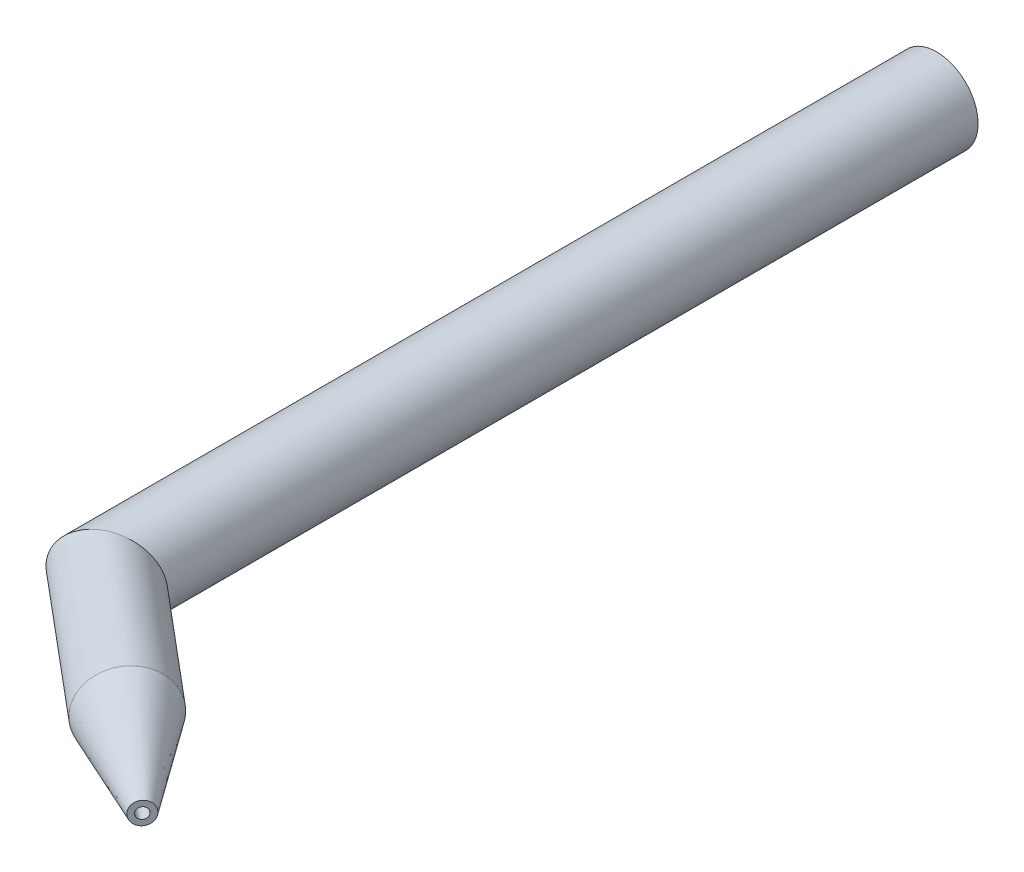
from build123d import *

# Parameters (mm, degrees)
SKETCH_1_R      = 7.5
SKETCH_1_R_2    = 4.5
EXTRUDE_1_DEPTH = 100
SKETCH_3_R      = 7.5
SKETCH_3_R_2    = 4.5
EXTRUDE_START   = 20
SKETCH_6_R      = 7.5
SKETCH_6_R_2    = 4.5
EXTRUDE_2_DEPTH = 20


with BuildPart() as part:
    # 草图1 → 凸台-拉伸1 (new body)
    with BuildSketch(Plane.XY):
        Circle(SKETCH_1_R)
        Circle(SKETCH_1_R_2, mode=Mode.SUBTRACT)
    extrude(amount=EXTRUDE_1_DEPTH)

    # 扫描1: sweep along a path in 草图2
    with BuildLine(Plane(origin=(0, 0, 0), x_dir=(1, 0, 0), z_dir=(0, 1, 0))) as sweep_1_path:
        Line((0, -100), (0, -130))
        Line((0, -130), (22.981333294, -149.283628291))
    # 草图3 → 扫描1 (sweep)
    with BuildSketch(Plane.XY.offset(100)):
        Circle(SKETCH_3_R)
        Circle(SKETCH_3_R_2, mode=Mode.SUBTRACT)
    sweep(path=sweep_1_path.line, transition=Transition.RIGHT)

    # 草图5 → 旋转1 (revolve)
    with BuildSketch(Plane(origin=(0, 0, 0), x_dir=(1, 0, 0), z_dir=(0, 1, 0)), mode=Mode.PRIVATE) as revolve_1_sk:
        Polygon((27.802240366, -143.538294967), (25.873877537, -145.836428297), (33.630329642, -156.91378991), (40.52252136, -162.697025438), (41.16530897, -161.930980995), (35.728697758, -154.448127615), align=None)
    revolve(revolve_1_sk.sketch.rotate(Axis((0, 0, 130), (0.7660444431189799, 0, 0.6427876096865373)), 180), axis=Axis((0, 0, 130), (0.7660444431189799, 0, 0.6427876096865373)))

    # 草图6 → 凸台-拉伸2 (add)
    with BuildSketch(Plane(origin=(0, 0, 0), x_dir=(-1, 0, 0), z_dir=(0, 0, -1)).offset(EXTRUDE_START)):
        Circle(SKETCH_6_R)
        Circle(SKETCH_6_R_2, mode=Mode.SUBTRACT)
    extrude(amount=-EXTRUDE_2_DEPTH)


solid = part.part
